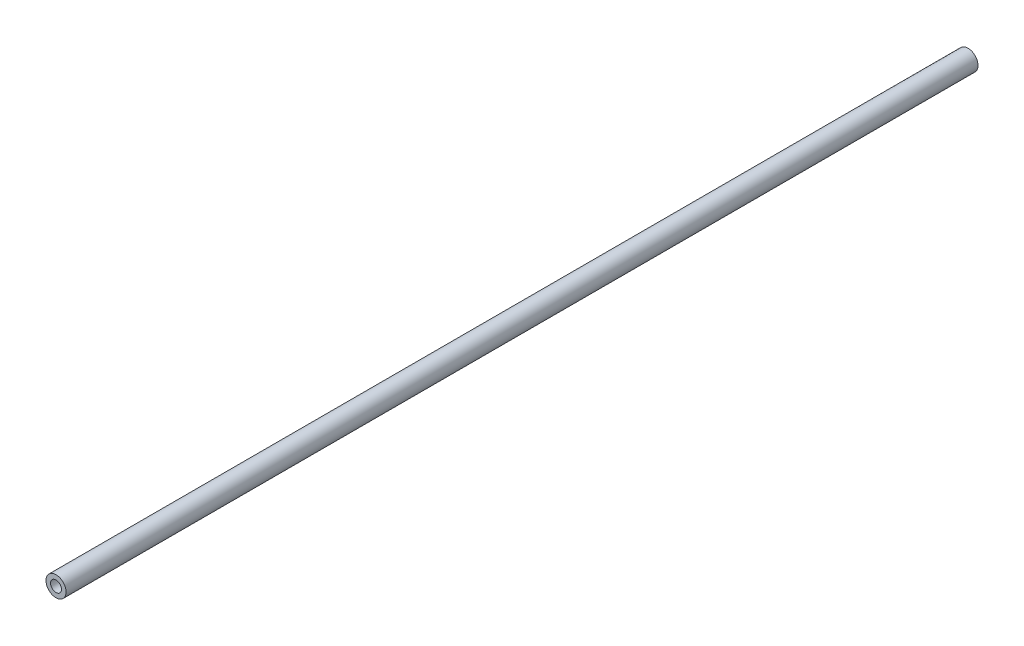
from build123d import *

# Parameters (mm, degrees)
SKETCH1_R           = 11
SKETCH1_R_2         = 6
BOSS_EXTRUDE1_DEPTH = 1000


with BuildPart() as part:
    # Sketch1 → Boss-Extrude1 (new body)
    with BuildSketch(Plane.XY):
        Circle(SKETCH1_R)
        Circle(SKETCH1_R_2, mode=Mode.SUBTRACT)
    extrude(amount=BOSS_EXTRUDE1_DEPTH)


solid = part.part
